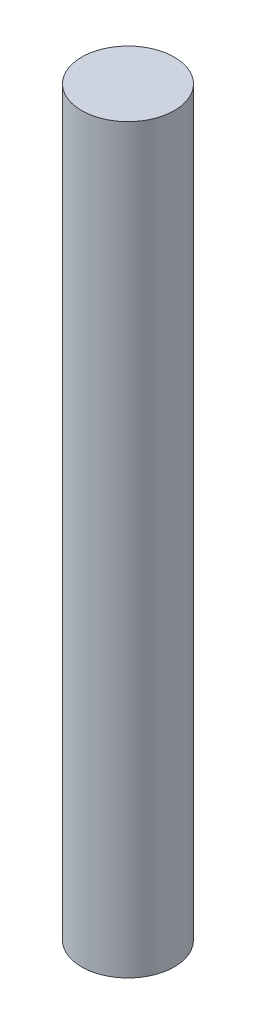
from build123d import *

# Parameters (mm, degrees)
SKETCH1_R           = 2.5
BOSS_EXTRUDE1_DEPTH = 20


with BuildPart() as part:
    # Sketch1 → Boss-Extrude1 (new, symmetric)
    with BuildSketch(Plane(origin=(0, 0, 0), x_dir=(1, 0, 0), z_dir=(0, 1, 0))):
        with Locations(Location((0, 0, 0), (0, 0, 270))):
            Circle(SKETCH1_R)
    extrude(amount=BOSS_EXTRUDE1_DEPTH, both=True)


solid = part.part
